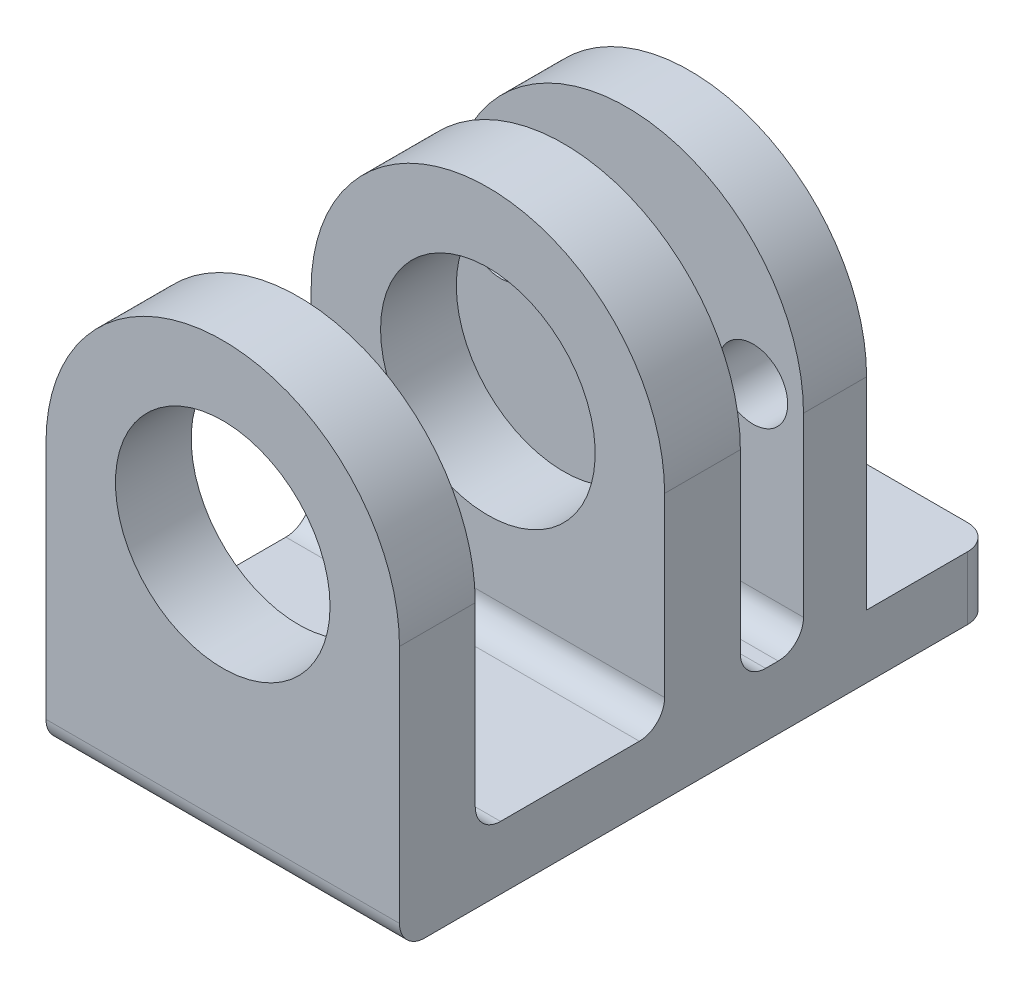
from build123d import *

# Parameters (mm, degrees)
SKETCH1_R           = 8.5
BOSS_EXTRUDE1_DEPTH = 6
SKETCH2_R           = 8.5
BOSS_EXTRUDE2_DEPTH = 6
SKETCH3_R           = 5
SKETCH3_R_2         = 2.75
BOSS_EXTRUDE3_DEPTH = 5
SKETCH4_W           = 28
SKETCH4_H           = 5
BOSS_EXTRUDE5_DEPTH = 47
FILLET1_R           = 2


with BuildPart() as part:
    # Sketch1 → Boss-Extrude1 (new body)
    with BuildSketch(Plane.XY):
        with BuildLine():
            Line((14, -16), (14, 0))
            ThreePointArc((14, 0), (0, 14), (-14, 0))
            Line((-14, 0), (-14, -16))
            Line((-14, -16), (14, -16))
        make_face()
        Circle(SKETCH1_R, mode=Mode.SUBTRACT)
    extrude(amount=BOSS_EXTRUDE1_DEPTH)



with BuildPart() as body_2:
    # Sketch2 → Boss-Extrude2 (new body)
    with BuildSketch(Plane(origin=(0, 0, -15), x_dir=(-1, 0, 0), z_dir=(0, 0, -1))):
        with BuildLine():
            Line((-14, -16), (-14, 0))
            ThreePointArc((-14, 0), (0, 14), (14, 0))
            Line((14, 0), (14, -16))
            Line((14, -16), (-14, -16))
        make_face()
        with Locations(Location((0, 0, 0), (0, 0, 180))):
            Circle(SKETCH2_R, mode=Mode.SUBTRACT)
    extrude(amount=BOSS_EXTRUDE2_DEPTH)


with BuildPart() as body_3:
    # Sketch3 → Boss-Extrude3 (new body)
    with BuildSketch(Plane(origin=(0, 0, -26), x_dir=(-1, 0, 0), z_dir=(0, 0, -1))):
        with BuildLine():
            Line((-14, -16), (14, -16))
            Line((14, -16), (14, 0))
            ThreePointArc((14, 0), (0, 14), (-14, 0))
            Line((-14, 0), (-14, -16))
        make_face()
        Circle(SKETCH3_R, mode=Mode.SUBTRACT)
        with Locations((-10, 0)):
            Circle(SKETCH3_R_2, mode=Mode.SUBTRACT)
        with Locations((10, 0)):
            Circle(SKETCH3_R_2, mode=Mode.SUBTRACT)
    extrude(amount=BOSS_EXTRUDE3_DEPTH)


with BuildPart() as part_1:
    add(part.part)

    add(body_2.part)  # Boss-Extrude5 merges body 2

    add(body_3.part)  # Boss-Extrude5 merges body 3
    # Sketch4 → Boss-Extrude5 (add)
    with BuildSketch(Plane.XY.offset(6)):
        with Locations((0, -18.5)):
            Rectangle(SKETCH4_W, SKETCH4_H)
    extrude(amount=-BOSS_EXTRUDE5_DEPTH)

    # Fillet1
    fillet1_edges = [part_1.edges().sort_by_distance(p)[0] for p in [
        (0, -21, 6),
        (14, -18.5, -41),
        (-14, -18.5, -41),
        (0, -16, -21),
        (0, -16, -15),
        (0, -16, -26),
        (0, -16, 0),
    ]]
    fillet(fillet1_edges, radius=FILLET1_R)


solid = part_1.part
